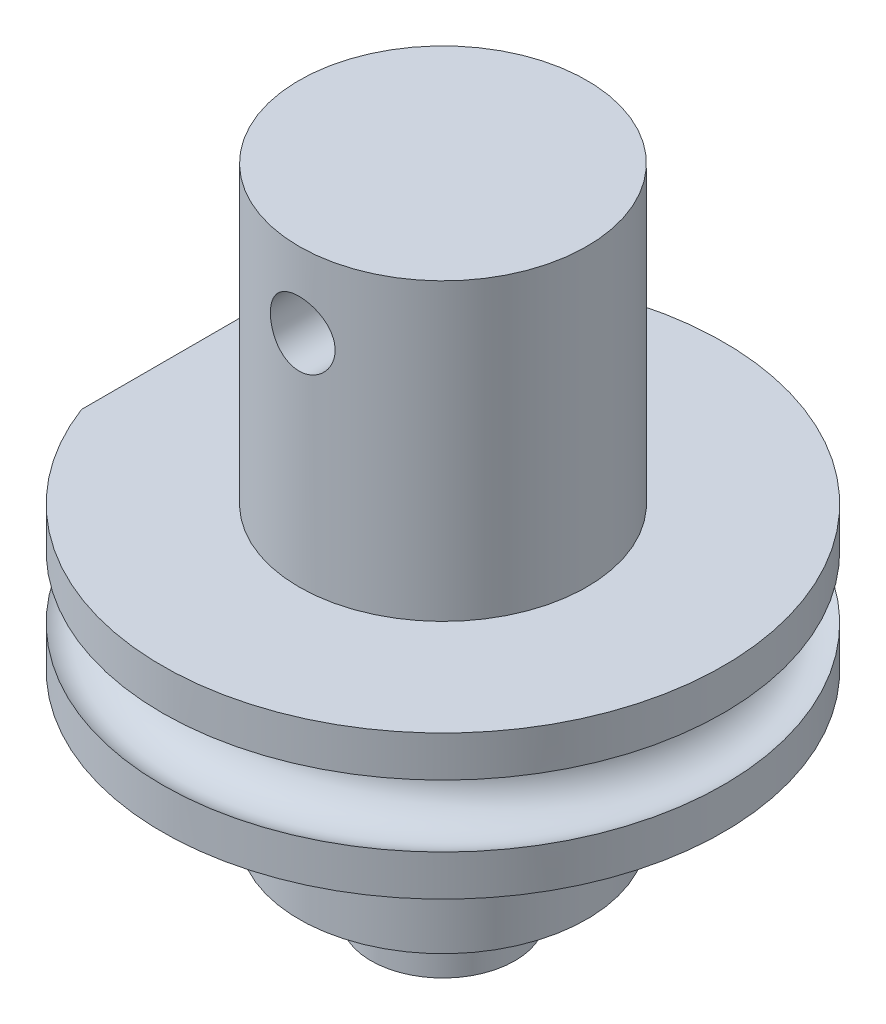
from build123d import *

# Parameters (mm, degrees)
SKETCH_1_R          = 7.8
EXTRUDE_1_DEPTH     = 4
SKETCH_2_R          = 4
EXTRUDE_2_DEPTH     = 8.2
SWEEP_1_PROFILE_R   = 1
SKETCH_10_R         = 0.9
CUT_EXTRUDE_3_DEPTH = 19.679400419
EXTRUDE_START       = 4
SKETCH_12_R         = 4
EXTRUDE_3_DEPTH     = 4
EXTRUDE_4_DEPTH     = 2
SKETCH_14_R         = 0.9
CUT_EXTRUDE_4_DEPTH = 5
SKETCH_15_W         = 7.770297698
SKETCH_15_H         = 4
CUT_EXTRUDE_5_DEPTH = 0.5


with BuildPart() as part:
    # 草图1 → 凸台-拉伸1 (new body)
    with BuildSketch(Plane(origin=(0, 0, 0), x_dir=(1, 0, 0), z_dir=(0, 1, 0))):
        with Locations(Location((0, 0, 0), (0, 0, 270))):
            Circle(SKETCH_1_R)
    extrude(amount=EXTRUDE_1_DEPTH)

    # 草图2 → 凸台-拉伸2 (add)
    with BuildSketch(Plane(origin=(0, 4, 0), x_dir=(1, 0, 0), z_dir=(0, 1, 0))):
        with Locations(Location((0, 0, 0), (0, 0, 270))):
            Circle(SKETCH_2_R)
    extrude(amount=EXTRUDE_2_DEPTH)

    # 切除-扫描1: sweep along a path in 草图5
    with BuildLine(Plane(origin=(0, 2, 0), x_dir=(1, 0, 0), z_dir=(0, 1, 0))) as sweep_1_path:
        CenterArc((0, 0), 7.3, 0, 360)
    # 切除-扫描1 profile (on start of the path) → 切除-扫描1 (sweep, cut)
    with BuildSketch(Plane(origin=(7.3, 2, 0), x_dir=(-1, 0, 0), z_dir=(0, 0, -1))):
        Circle(SWEEP_1_PROFILE_R)
    sweep(path=sweep_1_path.line, mode=Mode.SUBTRACT)

    # 草图10 → 切除-拉伸3 (cut, through all)
    with BuildSketch(Plane(origin=(0, 0, -4), x_dir=(-1, 0, 0), z_dir=(0, 0, -1))):
        with Locations(Location((0, 10.1, 0), (0, 0, 89.999999955))):
            Circle(SKETCH_10_R)
    extrude(amount=-CUT_EXTRUDE_3_DEPTH, mode=Mode.SUBTRACT)

    # 草图12 → 凸台-拉伸3 (add)
    with BuildSketch(Plane.XZ.offset(EXTRUDE_START)):
        with Locations(Location((0, 0, 0), (0, 0, 90))):
            Circle(SKETCH_12_R)
    extrude(amount=-EXTRUDE_3_DEPTH)

    # 草图13 → 凸台-拉伸4 (add)
    with BuildSketch(Plane.XZ.offset(4)):
        with BuildLine():
            ThreePointArc((2, 0), (1, 1.732050808), (-1, 1.732050808))
            Line((-1, 1.732050808), (-1, -1.732050808))
            ThreePointArc((-1, -1.732050808), (1, -1.732050808), (2, 0))
        make_face()
    extrude(amount=EXTRUDE_4_DEPTH)

    # 草图14 → 切除-拉伸4 (cut)
    with BuildSketch(Plane.ZY.offset(7.8)):
        with Locations((0, 2)):
            Circle(SKETCH_14_R)
    extrude(amount=-CUT_EXTRUDE_4_DEPTH, mode=Mode.SUBTRACT)

    # 草图15 → 切除-拉伸5 (cut)
    with BuildSketch(Plane.ZY.offset(7.8)):
        with Locations((0.165386451, 2)):
            Rectangle(SKETCH_15_W, SKETCH_15_H)
    extrude(amount=-CUT_EXTRUDE_5_DEPTH, mode=Mode.SUBTRACT)


solid = part.part
